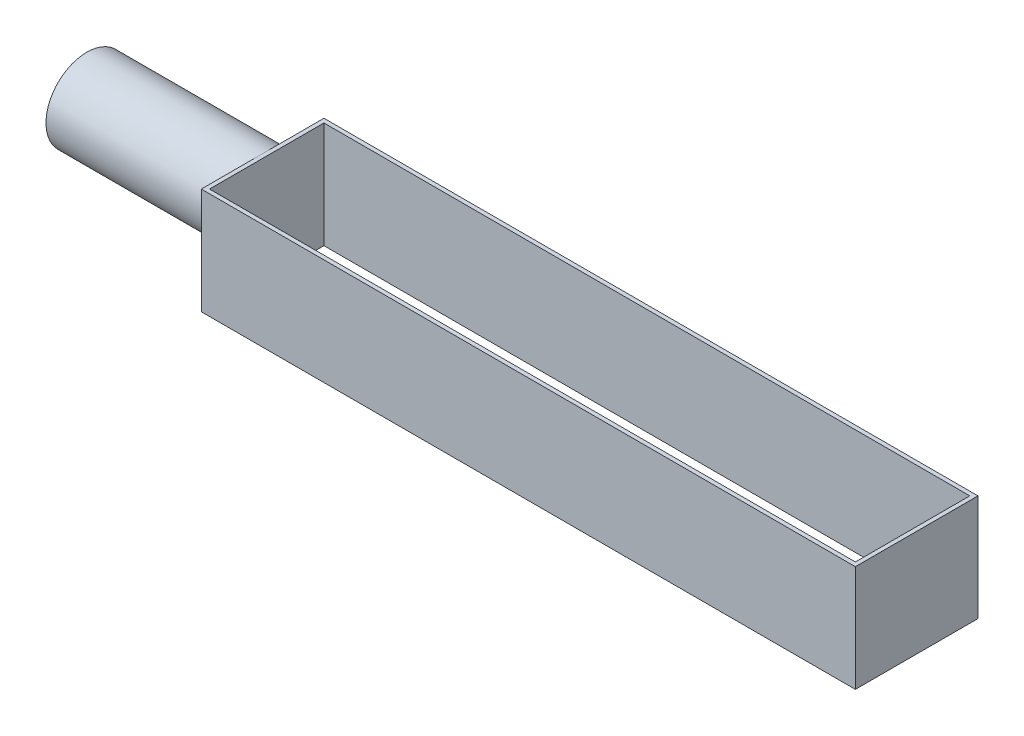
from build123d import *

# Parameters (mm, degrees)
SKETCH1_R                = 5
BOSS_EXTRUDE1_DEPTH      = 22
BOSS_EXTRUDE2_DEPTH      = 5
BOSS_EXTRUDE2_DEPTH_BACK = 8
SKETCH2_W                = 80
SKETCH2_H                = 15
SKETCH2_W_2              = 79
SKETCH2_H_2              = 14


with BuildPart() as part:
    # Sketch1 → Boss-Extrude1 (new body)
    with BuildSketch(Plane(origin=(0, 0, 0), x_dir=(0, 0, -1), z_dir=(1, 0, 0))):
        Circle(SKETCH1_R)
    extrude(amount=BOSS_EXTRUDE1_DEPTH)

    # Sketch2 → Boss-Extrude2 (add, two sides: drawn at the far end of the back side and taken through both)
    with BuildSketch(Plane(origin=(0, 0, 0), x_dir=(1, 0, 0), z_dir=(0, 1, 0)).offset(-BOSS_EXTRUDE2_DEPTH_BACK)):
        with Locations((61.5, 0)):
            Rectangle(SKETCH2_W, SKETCH2_H)
        with Locations((61.5, 0)):
            Rectangle(SKETCH2_W_2, SKETCH2_H_2, mode=Mode.SUBTRACT)
    extrude(amount=BOSS_EXTRUDE2_DEPTH + BOSS_EXTRUDE2_DEPTH_BACK)


solid = part.part
